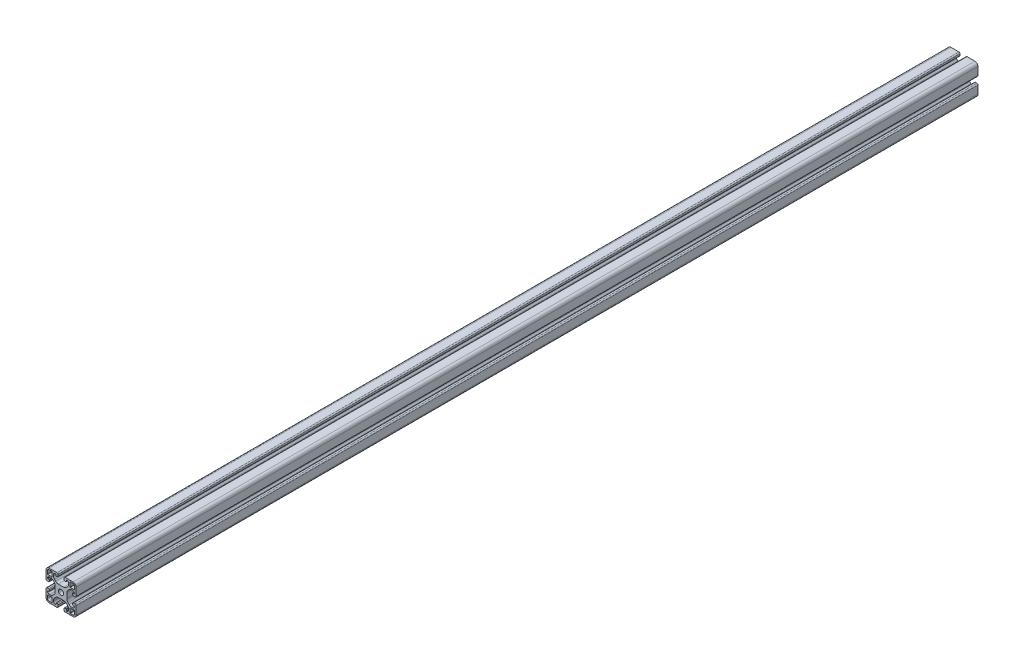
from build123d import *

# Parameters (mm, degrees)
ESQUISSE1_R        = 3.4
BOSS_EXTRU_1_DEPTH = 1200


with BuildPart() as part:
    # Esquisse1 → Boss.-Extru.1 (new body)
    with BuildSketch(Plane(origin=(0, 0, -30), x_dir=(-1, 0, 0), z_dir=(0, 0, -1))):
        with BuildLine():
            Line((-4.5, 15), (-4.5, 13.5))
            ThreePointArc((-4.5, 13.5), (-4.353553391, 13.146446609), (-4, 13))
            Line((-4, 13), (-2.5, 13))
            ThreePointArc((-2.5, 13), (-2.146446609, 12.853553391), (-2, 12.5))
            ThreePointArc((-2, 12.5), (-2.732233047, 10.732233047), (-4.5, 10))
            Line((-4.5, 10), (-5.807611845, 10))
            ThreePointArc((-5.807611845, 10), (-7.721029006, 10.380602337), (-9.343145751, 11.464466094))
            Line((-9.343145751, 11.464466094), (-10.785533906, 12.906854249))
            ThreePointArc((-10.785533906, 12.906854249), (-11.869397663, 14.528970994), (-12.25, 16.442388155))
            Line((-12.25, 16.442388155), (-12.25, 23.557611845))
            ThreePointArc((-12.25, 23.557611845), (-11.869397663, 25.471029006), (-10.785533906, 27.093145751))
            Line((-10.785533906, 27.093145751), (-9.343145751, 28.535533906))
            ThreePointArc((-9.343145751, 28.535533906), (-7.721029006, 29.619397663), (-5.807611845, 30))
            Line((-5.807611845, 30), (-4.5, 30))
            ThreePointArc((-4.5, 30), (-2.732233047, 29.267766953), (-2, 27.5))
            ThreePointArc((-2, 27.5), (-2.146446609, 27.146446609), (-2.5, 27))
            Line((-2.5, 27), (-4, 27))
            ThreePointArc((-4, 27), (-4.353553391, 26.853553391), (-4.5, 26.5))
            Line((-4.5, 26.5), (-4.5, 25))
            ThreePointArc((-4.5, 25), (-4.207106781, 24.292893219), (-3.5, 24))
            Line((-3.5, 24), (-1.5, 24))
            ThreePointArc((-1.5, 24), (-0.439339828, 24.439339828), (0, 25.5))
            Line((0, 25.5), (0, 36))
            ThreePointArc((0, 36), (-1.171572875, 38.828427125), (-4, 40))
            Line((-4, 40), (-14.5, 40))
            ThreePointArc((-14.5, 40), (-15.560660172, 39.560660172), (-16, 38.5))
            Line((-16, 38.5), (-16, 36.5))
            ThreePointArc((-16, 36.5), (-15.707106781, 35.792893219), (-15, 35.5))
            Line((-15, 35.5), (-13.5, 35.5))
            ThreePointArc((-13.5, 35.5), (-13.146446609, 35.646446609), (-13, 36))
            Line((-13, 36), (-13, 37.5))
            ThreePointArc((-13, 37.5), (-12.853553391, 37.853553391), (-12.5, 38))
            ThreePointArc((-12.5, 38), (-10.732233047, 37.267766953), (-10, 35.5))
            Line((-10, 35.5), (-10, 34.192388155))
            ThreePointArc((-10, 34.192388155), (-10.380602337, 32.278970994), (-11.464466094, 30.656854249))
            Line((-11.464466094, 30.656854249), (-12.906854249, 29.214466094))
            ThreePointArc((-12.906854249, 29.214466094), (-14.528970994, 28.130602337), (-16.442388155, 27.75))
            Line((-16.442388155, 27.75), (-23.557611845, 27.75))
            ThreePointArc((-23.557611845, 27.75), (-25.471029006, 28.130602337), (-27.093145751, 29.214466094))
            Line((-27.093145751, 29.214466094), (-28.535533906, 30.656854249))
            ThreePointArc((-28.535533906, 30.656854249), (-29.619397663, 32.278970994), (-30, 34.192388155))
            Line((-30, 34.192388155), (-30, 35.5))
            ThreePointArc((-30, 35.5), (-29.267766953, 37.267766953), (-27.5, 38))
            ThreePointArc((-27.5, 38), (-27.146446609, 37.853553391), (-27, 37.5))
            Line((-27, 37.5), (-27, 36))
            ThreePointArc((-27, 36), (-26.853553391, 35.646446609), (-26.5, 35.5))
            Line((-26.5, 35.5), (-25, 35.5))
            ThreePointArc((-25, 35.5), (-24.292893219, 35.792893219), (-24, 36.5))
            Line((-24, 36.5), (-24, 38.5))
            ThreePointArc((-24, 38.5), (-24.439339828, 39.560660172), (-25.5, 40))
            Line((-25.5, 40), (-36, 40))
            ThreePointArc((-36, 40), (-38.828427125, 38.828427125), (-40, 36))
            Line((-40, 36), (-40, 25.5))
            ThreePointArc((-40, 25.5), (-39.560660172, 24.439339828), (-38.5, 24))
            Line((-38.5, 24), (-36.5, 24))
            ThreePointArc((-36.5, 24), (-35.792893219, 24.292893219), (-35.5, 25))
            Line((-35.5, 25), (-35.5, 26.5))
            ThreePointArc((-35.5, 26.5), (-35.646446609, 26.853553391), (-36, 27))
            Line((-36, 27), (-37.5, 27))
            ThreePointArc((-37.5, 27), (-37.853553391, 27.146446609), (-38, 27.5))
            ThreePointArc((-38, 27.5), (-37.267766953, 29.267766953), (-35.5, 30))
            Line((-35.5, 30), (-34.192388155, 30))
            ThreePointArc((-34.192388155, 30), (-32.278970994, 29.619397663), (-30.656854249, 28.535533906))
            Line((-30.656854249, 28.535533906), (-29.214466094, 27.093145751))
            ThreePointArc((-29.214466094, 27.093145751), (-28.130602337, 25.471029006), (-27.75, 23.557611845))
            Line((-27.75, 23.557611845), (-27.75, 16.442388155))
            ThreePointArc((-27.75, 16.442388155), (-28.130602337, 14.528970994), (-29.214466094, 12.906854249))
            Line((-29.214466094, 12.906854249), (-30.656854249, 11.464466094))
            ThreePointArc((-30.656854249, 11.464466094), (-32.278970994, 10.380602337), (-34.192388155, 10))
            Line((-34.192388155, 10), (-35.5, 10))
            ThreePointArc((-35.5, 10), (-37.267766953, 10.732233047), (-38, 12.5))
            ThreePointArc((-38, 12.5), (-37.853553391, 12.853553391), (-37.5, 13))
            Line((-37.5, 13), (-36, 13))
            ThreePointArc((-36, 13), (-35.646446609, 13.146446609), (-35.5, 13.5))
            Line((-35.5, 13.5), (-35.5, 15))
            ThreePointArc((-35.5, 15), (-35.792893219, 15.707106781), (-36.5, 16))
            Line((-36.5, 16), (-38.5, 16))
            ThreePointArc((-38.5, 16), (-39.560660172, 15.560660172), (-40, 14.5))
            Line((-40, 14.5), (-40, 4))
            ThreePointArc((-40, 4), (-38.828427125, 1.171572875), (-36, 0))
            Line((-36, 0), (-25.5, 0))
            ThreePointArc((-25.5, 0), (-24.439339828, 0.439339828), (-24, 1.5))
            Line((-24, 1.5), (-24, 3.5))
            ThreePointArc((-24, 3.5), (-24.292893219, 4.207106781), (-25, 4.5))
            Line((-25, 4.5), (-26.5, 4.5))
            ThreePointArc((-26.5, 4.5), (-26.853553391, 4.353553391), (-27, 4))
            Line((-27, 4), (-27, 2.5))
            ThreePointArc((-27, 2.5), (-27.146446609, 2.146446609), (-27.5, 2))
            ThreePointArc((-27.5, 2), (-29.267766953, 2.732233047), (-30, 4.5))
            Line((-30, 4.5), (-30, 5.807611845))
            ThreePointArc((-30, 5.807611845), (-29.619397663, 7.721029006), (-28.535533906, 9.343145751))
            Line((-28.535533906, 9.343145751), (-27.093145751, 10.785533906))
            ThreePointArc((-27.093145751, 10.785533906), (-25.471029006, 11.869397663), (-23.557611845, 12.25))
            Line((-23.557611845, 12.25), (-16.442388155, 12.25))
            ThreePointArc((-16.442388155, 12.25), (-14.528970994, 11.869397663), (-12.906854249, 10.785533906))
            Line((-12.906854249, 10.785533906), (-11.464466094, 9.343145751))
            ThreePointArc((-11.464466094, 9.343145751), (-10.380602337, 7.721029006), (-10, 5.807611845))
            Line((-10, 5.807611845), (-10, 4.5))
            ThreePointArc((-10, 4.5), (-10.732233047, 2.732233047), (-12.5, 2))
            ThreePointArc((-12.5, 2), (-12.853553391, 2.146446609), (-13, 2.5))
            Line((-13, 2.5), (-13, 4))
            ThreePointArc((-13, 4), (-13.146446609, 4.353553391), (-13.5, 4.5))
            Line((-13.5, 4.5), (-15, 4.5))
            ThreePointArc((-15, 4.5), (-15.707106781, 4.207106781), (-16, 3.5))
            Line((-16, 3.5), (-16, 1.5))
            ThreePointArc((-16, 1.5), (-15.560660172, 0.439339828), (-14.5, 0))
            Line((-14.5, 0), (-4, 0))
            ThreePointArc((-4, 0), (-1.171572875, 1.171572875), (0, 4))
            Line((0, 4), (0, 14.5))
            ThreePointArc((0, 14.5), (-0.439339828, 15.560660172), (-1.5, 16))
            Line((-1.5, 16), (-3.5, 16))
            ThreePointArc((-3.5, 16), (-4.207106781, 15.707106781), (-4.5, 15))
        make_face()
        with Locations(Location((-20, 20, 0), (0, 0, 180))):
            Circle(ESQUISSE1_R, mode=Mode.SUBTRACT)
        with BuildLine():
            Line((-4, 1.8), (-7.7, 1.8))
            ThreePointArc((-7.7, 1.8), (-8.053553391, 1.946446609), (-8.2, 2.3))
            Line((-8.2, 2.3), (-8.2, 7.7))
            ThreePointArc((-8.2, 7.7), (-8.053553391, 8.053553391), (-7.7, 8.2))
            Line((-7.7, 8.2), (-2.3, 8.2))
            ThreePointArc((-2.3, 8.2), (-1.946446609, 8.053553391), (-1.8, 7.7))
            Line((-1.8, 7.7), (-1.8, 4))
            ThreePointArc((-1.8, 4), (-2.444365081, 2.444365081), (-4, 1.8))
        make_face(mode=Mode.SUBTRACT)
        with BuildLine():
            Line((-38.2, 4), (-38.2, 7.7))
            ThreePointArc((-38.2, 7.7), (-38.053553391, 8.053553391), (-37.7, 8.2))
            Line((-37.7, 8.2), (-32.3, 8.2))
            ThreePointArc((-32.3, 8.2), (-31.946446609, 8.053553391), (-31.8, 7.7))
            Line((-31.8, 7.7), (-31.8, 2.3))
            ThreePointArc((-31.8, 2.3), (-31.946446609, 1.946446609), (-32.3, 1.8))
            Line((-32.3, 1.8), (-36, 1.8))
            ThreePointArc((-36, 1.8), (-37.555634919, 2.444365081), (-38.2, 4))
        make_face(mode=Mode.SUBTRACT)
        with BuildLine():
            Line((-36, 38.2), (-32.3, 38.2))
            ThreePointArc((-32.3, 38.2), (-31.946446609, 38.053553391), (-31.8, 37.7))
            Line((-31.8, 37.7), (-31.8, 32.3))
            ThreePointArc((-31.8, 32.3), (-31.946446609, 31.946446609), (-32.3, 31.8))
            Line((-32.3, 31.8), (-37.7, 31.8))
            ThreePointArc((-37.7, 31.8), (-38.053553391, 31.946446609), (-38.2, 32.3))
            Line((-38.2, 32.3), (-38.2, 36))
            ThreePointArc((-38.2, 36), (-37.555634919, 37.555634919), (-36, 38.2))
        make_face(mode=Mode.SUBTRACT)
        with BuildLine():
            Line((-1.8, 36), (-1.8, 32.3))
            ThreePointArc((-1.8, 32.3), (-1.946446609, 31.946446609), (-2.3, 31.8))
            Line((-2.3, 31.8), (-7.7, 31.8))
            ThreePointArc((-7.7, 31.8), (-8.053553391, 31.946446609), (-8.2, 32.3))
            Line((-8.2, 32.3), (-8.2, 37.7))
            ThreePointArc((-8.2, 37.7), (-8.053553391, 38.053553391), (-7.7, 38.2))
            Line((-7.7, 38.2), (-4, 38.2))
            ThreePointArc((-4, 38.2), (-2.444365081, 37.555634919), (-1.8, 36))
        make_face(mode=Mode.SUBTRACT)
    extrude(amount=-BOSS_EXTRU_1_DEPTH)


solid = part.part
